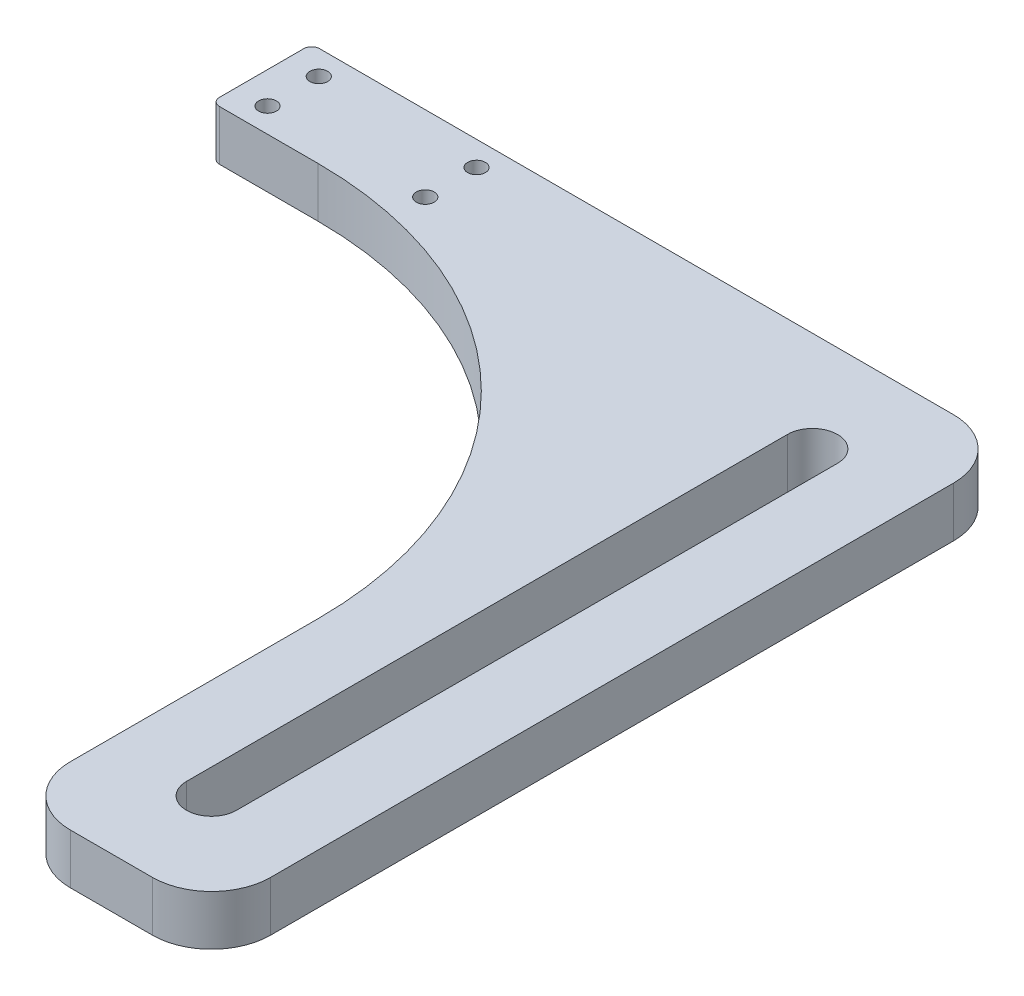
from build123d import *

# Parameters (mm, degrees)
SKETCH1_R           = 1.1303
BOSS_EXTRUDE2_DEPTH = 6.35
FILLET1_R           = 1
FILLET2_R           = 7.5


with BuildPart() as part:
    # Sketch1 → Boss-Extrude2 (new body)
    with BuildSketch(Plane(origin=(0, 0, 0), x_dir=(1, 0, 0), z_dir=(0, 1, 0))):
        with BuildLine():
            Line((-12.7, 50.8), (-76.2, 50.8))
            Line((-76.2, 50.8), (-76.2, 38.1))
            Line((-76.2, 38.1), (-62.7, 38.1))
            ThreePointArc((-62.7, 38.1), (-27.344660941, 23.455339059), (-12.7, -11.9))
            Line((-12.7, -11.9), (-12.7, -50.8))
            Line((-12.7, -50.8), (12.7, -50.8))
            Line((12.7, -50.8), (12.7, 50.8))
            Line((12.7, 50.8), (-12.7, 50.8))
        make_face()
        with Locations(Location((-72.2, 47.7, 0), (0, 0, 270))):
            Circle(SKETCH1_R, mode=Mode.SUBTRACT)
        with Locations(Location((-72.2, 41.2, 0), (0, 0, 270))):
            Circle(SKETCH1_R, mode=Mode.SUBTRACT)
        with Locations(Location((-52.2, 47.7, 0), (0, 0, 270))):
            Circle(SKETCH1_R, mode=Mode.SUBTRACT)
        with Locations(Location((-52.2, 41.2, 0), (0, 0, 270))):
            Circle(SKETCH1_R, mode=Mode.SUBTRACT)
        with BuildLine():
            Line((-3.175, -38.1), (-3.175, 38.1))
            ThreePointArc((-3.175, 38.1), (0, 41.275), (3.175, 38.1))
            Line((3.175, 38.1), (3.175, -38.1))
            ThreePointArc((3.175, -38.1), (0, -41.275), (-3.175, -38.1))
        make_face(mode=Mode.SUBTRACT)
    extrude(amount=BOSS_EXTRUDE2_DEPTH)

    # Fillet1
    fillet1_edges = [part.edges().sort_by_distance(p)[0] for p in [
        (-76.2, 3.175, -38.1),
        (-76.2, 3.175, -50.8),
    ]]
    fillet(fillet1_edges, radius=FILLET1_R)

    # Fillet2
    fillet2_edges = [part.edges().sort_by_distance(p)[0] for p in [
        (12.7, 3.175, 50.8),
        (-12.7, 3.175, 50.8),
        (12.7, 3.175, -50.8),
    ]]
    fillet(fillet2_edges, radius=FILLET2_R)


solid = part.part
